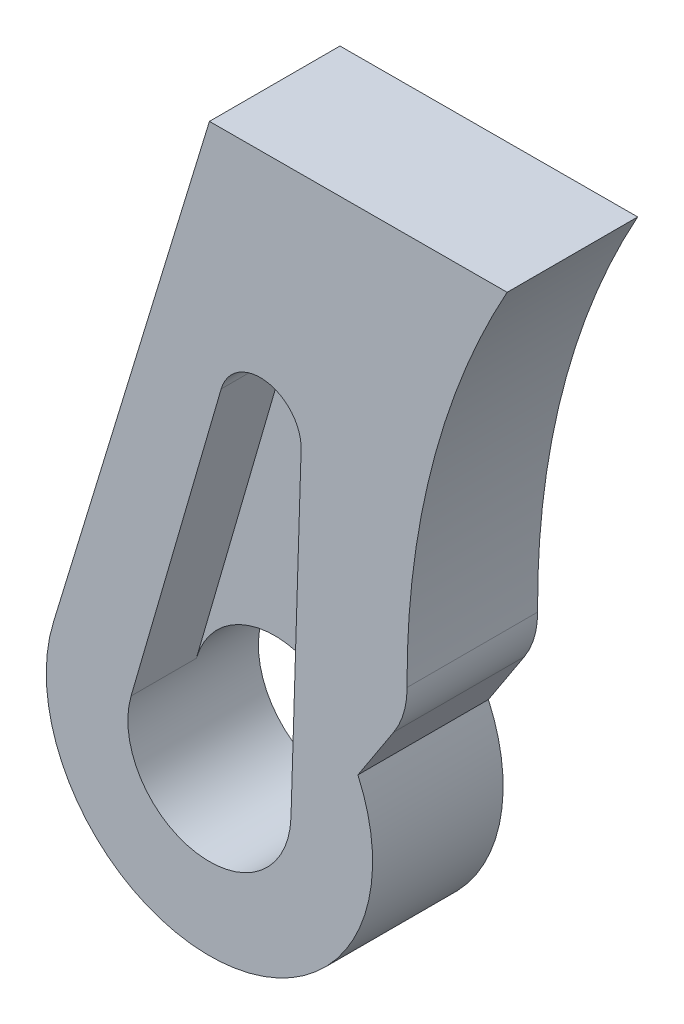
from build123d import *

# Parameters (mm, degrees)
SKETCH1_R           = 2.5
BOSS_EXTRUDE1_DEPTH = 8
CUT_EXTRUDE1_START  = 4
CUT_EXTRUDE1_DEPTH  = 4
FILLET1_R           = 5


with BuildPart() as part:
    # Sketch1 → Boss-Extrude1 (new body)
    with BuildSketch(Plane.XY):
        with BuildLine():
            ThreePointArc((9.097153376, 4.152324704), (7.50458322, 6.609177763), (5.268689672, 8.499465227))
            Line((5.268689672, 8.499465227), (4.99754882, -0.156543244))
            ThreePointArc((4.99754882, -0.156543244), (-0.780009037, -4.938783848), (-4.802546561, 1.391239206))
            Line((-4.802546561, 1.391239206), (-2.392849571, 9.709493855))
            ThreePointArc((-2.392849571, 9.709493855), (-6.876600935, 7.260327787), (-9.565391616, 2.916038962))
            ThreePointArc((-9.565391616, 2.916038962), (-1.474124119, -9.890751138), (10, 0))
            ThreePointArc((10, 0), (9.771681886, 2.124672473), (9.097153376, 4.152324704))
        make_face()
        with BuildLine():
            Line((4.99754882, -0.156543244), (5.268689672, 8.499465227))
            ThreePointArc((5.268689672, 8.499465227), (1.560018074, 9.877567697), (-2.392849571, 9.709493855))
            Line((-2.392849571, 9.709493855), (-4.802546561, 1.391239206))
            ThreePointArc((-4.802546561, 1.391239206), (0.702590633, 4.95039053), (5, 0))
            ThreePointArc((5, 0), (4.999387168, -0.078281216), (4.99754882, -0.156543244))
        make_face()
        with BuildLine():
            ThreePointArc((5.620036149, 19.755135394), (5.619729732, 19.715994786), (5.618810559, 19.676863772))
            Line((5.618810559, 19.676863772), (5.268689672, 8.499465227))
            ThreePointArc((5.268689672, 8.499465227), (7.50458322, 6.609177763), (9.097153376, 4.152324704))
            Line((9.097153376, 4.152324704), (12.147237195, 8.825258116))
            ThreePointArc((12.147237195, 8.825258116), (13.442669974, 22.004389763), (18.247609257, 34.344576778))
            Line((18.247609257, 34.344576778), (0, 34.293094604))
            Line((0, 34.293094604), (-9.565391616, 2.916038962))
            ThreePointArc((-9.565391616, 2.916038962), (-6.876600935, 7.260327787), (-2.392849571, 9.709493855))
            Line((-2.392849571, 9.709493855), (0.718762868, 20.450754997))
            ThreePointArc((0.718762868, 20.450754997), (3.471331465, 22.230330659), (5.620036149, 19.755135394))
        make_face()
        with BuildLine():
            Line((5.268689672, 8.499465227), (5.618810559, 19.676863772))
            ThreePointArc((5.618810559, 19.676863772), (2.73003163, 17.28574347), (0.718762868, 20.450754997))
            Line((0.718762868, 20.450754997), (-2.392849571, 9.709493855))
            ThreePointArc((-2.392849571, 9.709493855), (1.560018074, 9.877567697), (5.268689672, 8.499465227))
        make_face()
        with Locations((3.120036149, 19.755135394)):
            Circle(SKETCH1_R)
    extrude(amount=BOSS_EXTRUDE1_DEPTH)

    # Sketch1<3> → Cut-Extrude1 (cut)
    with BuildSketch(Plane.XY.offset(CUT_EXTRUDE1_START)):
        with BuildLine():
            ThreePointArc((5.618810559, 19.676863772), (3.510040667, 22.224527318), (0.718762868, 20.450754997))
            Line((0.718762868, 20.450754997), (-4.802546561, 1.391239206))
            ThreePointArc((-4.802546561, 1.391239206), (0.780009037, 4.938783848), (4.99754882, -0.156543244))
            Line((4.99754882, -0.156543244), (5.618810559, 19.676863772))
        make_face()
    extrude(amount=CUT_EXTRUDE1_DEPTH, mode=Mode.SUBTRACT)

    # Fillet1
    fillet1_edges = [part.edges().sort_by_distance(p)[0] for p in [
        (12.147237195, 8.825258116, 4),
    ]]
    fillet(fillet1_edges, radius=FILLET1_R)


solid = part.part
